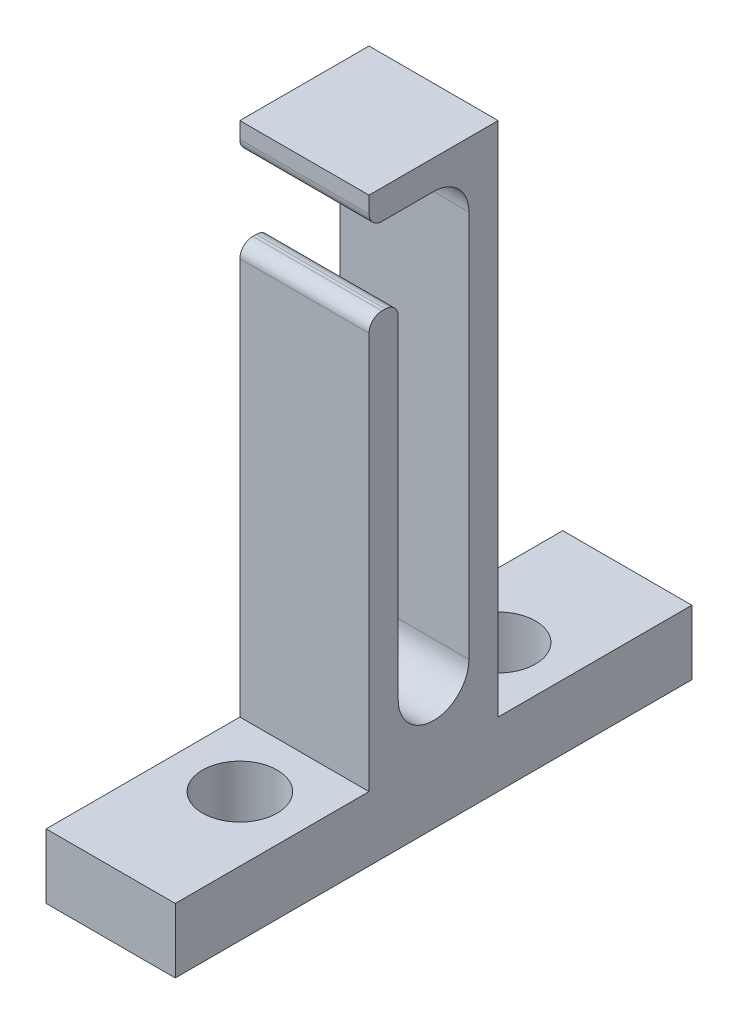
from build123d import *

# Parameters (mm, degrees)
SKETCH1_W           = 12.7
SKETCH1_H           = 50.8
BOSS_EXTRUDE1_DEPTH = 12.7
CUT_EXTRUDE1_DEPTH  = 32.108519733
FILLET1_R           = 1.27
SKETCH3_W           = 12.7
SKETCH3_H           = 50.8
SKETCH3_R           = 3.675
BOSS_EXTRUDE2_DEPTH = 6.35


with BuildPart() as part:
    # Sketch1 → Boss-Extrude1 (new body)
    with BuildSketch(Plane.XY):
        Rectangle(SKETCH1_W, SKETCH1_H)
    extrude(amount=BOSS_EXTRUDE1_DEPTH)

    # Sketch2 → Cut-Extrude1 (cut, through all)
    with BuildSketch(Plane(origin=(6.35, 0, 0), x_dir=(0, 0, -1), z_dir=(1, 0, 0))):
        with BuildLine():
            Line((-2.875000092, 19.05), (-2.875000092, -19.05))
            ThreePointArc((-2.875000092, -19.05), (-6.35, -22.524999908), (-9.824999908, -19.05))
            Line((-9.824999908, -19.05), (-9.824999908, 14.904999908))
            Line((-9.824999908, 14.904999908), (-12.7, 14.904999908))
            Line((-12.7, 14.904999908), (-12.7, 22.524999908))
            Line((-12.7, 22.524999908), (-9.824999908, 22.524999908))
            Line((-9.824999908, 22.524999908), (-6.35, 22.524999908))
            ThreePointArc((-6.35, 22.524999908), (-3.892804, 21.507196), (-2.875000092, 19.05))
        make_face()
    extrude(amount=-CUT_EXTRUDE1_DEPTH, mode=Mode.SUBTRACT)

    # Fillet1
    fillet1_edges = [part.edges().sort_by_distance(p)[0] for p in [
        (0, 14.904999908, 9.824999908),
        (0, 14.904999908, 12.7),
        (0, 22.524999908, 12.7),
    ]]
    fillet(fillet1_edges, radius=FILLET1_R)

    # Sketch3 → Boss-Extrude2 (add)
    with BuildSketch(Plane.XZ.offset(25.4)):
        with Locations((0, 6.35)):
            Rectangle(SKETCH3_W, SKETCH3_H)
        with Locations(Location((0, -6.35, 0), (0, 0, 270))):
            Circle(SKETCH3_R, mode=Mode.SUBTRACT)
        with Locations(Location((0, 19.05, 0), (0, 0, 270))):
            Circle(SKETCH3_R, mode=Mode.SUBTRACT)
    extrude(amount=BOSS_EXTRUDE2_DEPTH)


solid = part.part
